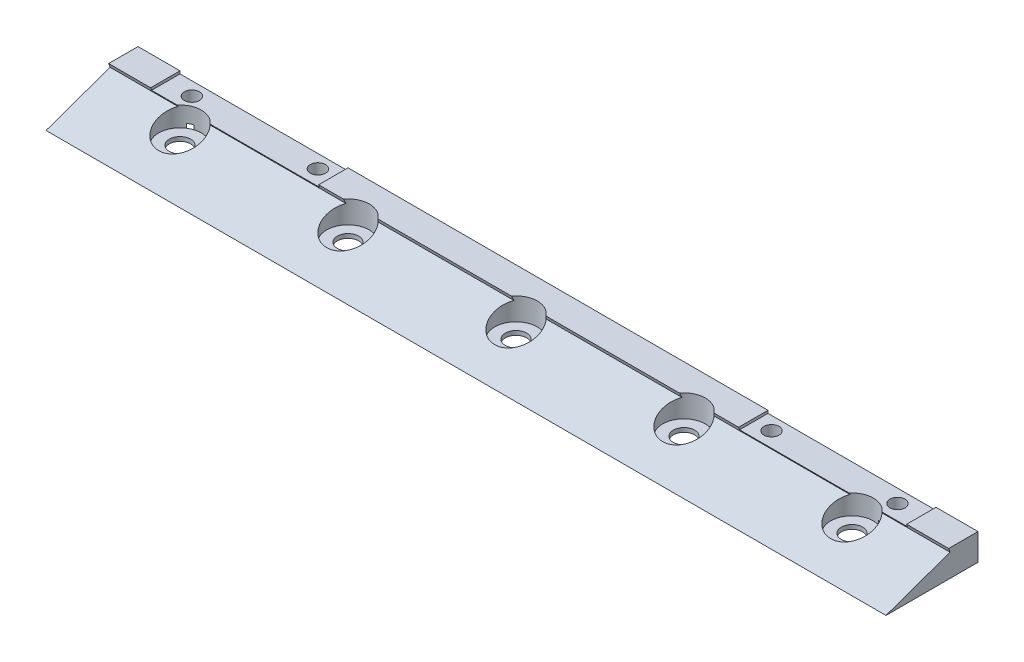
from build123d import *

# Parameters (mm, degrees)
SKETCH1_W            = 200
SKETCH1_H            = 30
BASE_DEPTH           = 6.35
WEDGECUT_REACH       = 202.662
SKETCH3_W            = 40
SKETCH3_H            = 8
HINGE_CUTOUT_DEPTH   = 0.635
HINGE_HOLE_CUT_REACH = 103.28
SKETCH4_R            = 1.8034
SKETCH5_W            = 5.05
SKETCH5_H            = 5.05
HINGE_NUT_CUT_DEPTH  = 2
SKETCH6_R            = 5.08
CUT_EXTRUDE1_DEPTH   = 102.317927831
SKETCH7_R            = 5.08
SKETCH7_R_2          = 2.54
BOSS_EXTRUDE1_DEPTH  = 1


with BuildPart() as part:
    # Sketch1 → Base (new body)
    with BuildSketch(Plane(origin=(0, 0, 0), x_dir=(1, 0, 0), z_dir=(0, 1, 0))):
        Rectangle(SKETCH1_W, SKETCH1_H)
    extrude(amount=BASE_DEPTH)

    # Sketch2 → WedgeCut (cut, up to next)
    with BuildSketch(Plane(origin=(100, 0, 0), x_dir=(0, 0, -1), z_dir=(1, 0, 0)), mode=Mode.PRIVATE) as wedgecut_sk1:
        Polygon((-15, 0), (-6.907470508, 0), (8.342084542, 5.407501552), (8.007874016, 6.35), (-15, 6.35), align=None)
    wedgecut_tool1 = extrude(wedgecut_sk1.sketch, amount=-WEDGECUT_REACH, mode=Mode.PRIVATE) & part.part
    add(wedgecut_tool1.solids().sort_by_distance((100, 3.70048, 5.888491))[0], mode=Mode.SUBTRACT)

    # Sketch3 → Hinge Cutout (cut)
    with BuildSketch(Plane(origin=(0, 6.35, 0), x_dir=(1, 0, 0), z_dir=(0, 1, 0))):
        with Locations((-69.999999934, 11)):
            Rectangle(SKETCH3_W, SKETCH3_H)
        with Locations((70, 11)):
            Rectangle(SKETCH3_W, SKETCH3_H)
    extrude(amount=-HINGE_CUTOUT_DEPTH, mode=Mode.SUBTRACT)

    # Sketch4 → Hinge Hole Cut (cut, up to next)
    with BuildSketch(Plane(origin=(0, 5.715, 0), x_dir=(1, 0, 0), z_dir=(0, 1, 0)), mode=Mode.PRIVATE) as hinge_hole_cut_sk1:
        with Locations(Location((54, 11.825, 0), (0, 0, 270))):
            Circle(SKETCH4_R)
    hinge_hole_cut_tool1 = extrude(hinge_hole_cut_sk1.sketch, amount=-HINGE_HOLE_CUT_REACH, mode=Mode.PRIVATE) & part.part
    # Sketch4 → Hinge Hole Cut (cut, up to next)
    with BuildSketch(Plane(origin=(0, 5.715, 0), x_dir=(1, 0, 0), z_dir=(0, 1, 0)), mode=Mode.PRIVATE) as hinge_hole_cut_sk2:
        with Locations(Location((84, 11.825, 0), (0, 0, 270))):
            Circle(SKETCH4_R)
    hinge_hole_cut_tool2 = extrude(hinge_hole_cut_sk2.sketch, amount=-HINGE_HOLE_CUT_REACH, mode=Mode.PRIVATE) & part.part
    hinge_hole_cut_1 = hinge_hole_cut_tool1.solids().sort_by_distance((54, 5.715, -11.825))[0]
    add(hinge_hole_cut_1, mode=Mode.SUBTRACT)
    hinge_hole_cut_2 = hinge_hole_cut_tool2.solids().sort_by_distance((84, 5.715, -11.825))[0]
    add(hinge_hole_cut_2, mode=Mode.SUBTRACT)
    hinge_hole_cut = hinge_hole_cut_1 + hinge_hole_cut_2  # Hinge Hole Cut as one shape, for the pattern or mirror that repeats it

    # Sketch5 → Hinge Nut Cut (cut)
    with BuildSketch(Plane.XZ):
        with Locations((54, -11.825)):
            Rectangle(SKETCH5_W, SKETCH5_H)
        with Locations((84, -11.825)):
            Rectangle(SKETCH5_W, SKETCH5_H)
    hinge_nut_cut = extrude(amount=-HINGE_NUT_CUT_DEPTH, mode=Mode.SUBTRACT)

    # Hinge Hole Mirror: Hinge Hole Cut, Hinge Nut Cut across plane
    add(hinge_hole_cut.mirror(Plane(origin=(0, 0, 0), x_dir=(0, 0, 1), z_dir=(1, 0, 0))), mode=Mode.SUBTRACT)
    add(hinge_nut_cut.mirror(Plane(origin=(0, 0, 0), x_dir=(0, 0, 1), z_dir=(1, 0, 0))), mode=Mode.SUBTRACT)

    # Sketch6 → Cut-Extrude1 (cut, through all)
    with BuildSketch(Plane(origin=(0, 0, 0), x_dir=(-1, 0, 0), z_dir=(0, -1, 0))):
        with Locations(Location((-80, 5, 0), (0, 0, 106.879170472))):
            Circle(SKETCH6_R)
        with Locations(Location((-40, 5, 0), (0, 0, 90))):
            Circle(SKETCH6_R)
        with Locations(Location((0, 5, 0), (0, 0, 90))):
            Circle(SKETCH6_R)
        with Locations(Location((40, 5, 0), (0, 0, 90))):
            Circle(SKETCH6_R)
        with Locations(Location((80, 5, 0), (0, 0, 73.120829528))):
            Circle(SKETCH6_R)
    extrude(amount=-CUT_EXTRUDE1_DEPTH, mode=Mode.SUBTRACT)

    # Sketch7 → Boss-Extrude1 (add)
    # profile 1 of 5: a face of its own
    with BuildSketch(Plane.XZ):
        with Locations(Location((-80, -5, 0), (0, 0, 253.120829528))):
            Circle(SKETCH7_R)
        with Locations(Location((-80, -5, 0), (0, 0, 270))):
            Circle(SKETCH7_R_2, mode=Mode.SUBTRACT)
    # profile 2 of 5: a face of its own
    with BuildSketch(Plane.XZ):
        with Locations(Location((-40, -5, 0), (0, 0, 270))):
            Circle(SKETCH7_R)
        with Locations(Location((-40, -5, 0), (0, 0, 270))):
            Circle(SKETCH7_R_2, mode=Mode.SUBTRACT)
    # profile 3 of 5: a face of its own
    with BuildSketch(Plane.XZ):
        with Locations(Location((0, -5, 0), (0, 0, 270))):
            Circle(SKETCH7_R)
        with Locations(Location((0, -5, 0), (0, 0, 270))):
            Circle(SKETCH7_R_2, mode=Mode.SUBTRACT)
    # profile 4 of 5: a face of its own
    with BuildSketch(Plane.XZ):
        with Locations(Location((40, -5, 0), (0, 0, 270))):
            Circle(SKETCH7_R)
        with Locations(Location((40, -5, 0), (0, 0, 270))):
            Circle(SKETCH7_R_2, mode=Mode.SUBTRACT)
    # profile 5 of 5: a face of its own
    with BuildSketch(Plane.XZ):
        with Locations(Location((80, -5, 0), (0, 0, 286.879170472))):
            Circle(SKETCH7_R)
        with Locations(Location((80, -5, 0), (0, 0, 270))):
            Circle(SKETCH7_R_2, mode=Mode.SUBTRACT)
    extrude(amount=-BOSS_EXTRUDE1_DEPTH)


solid = part.part
